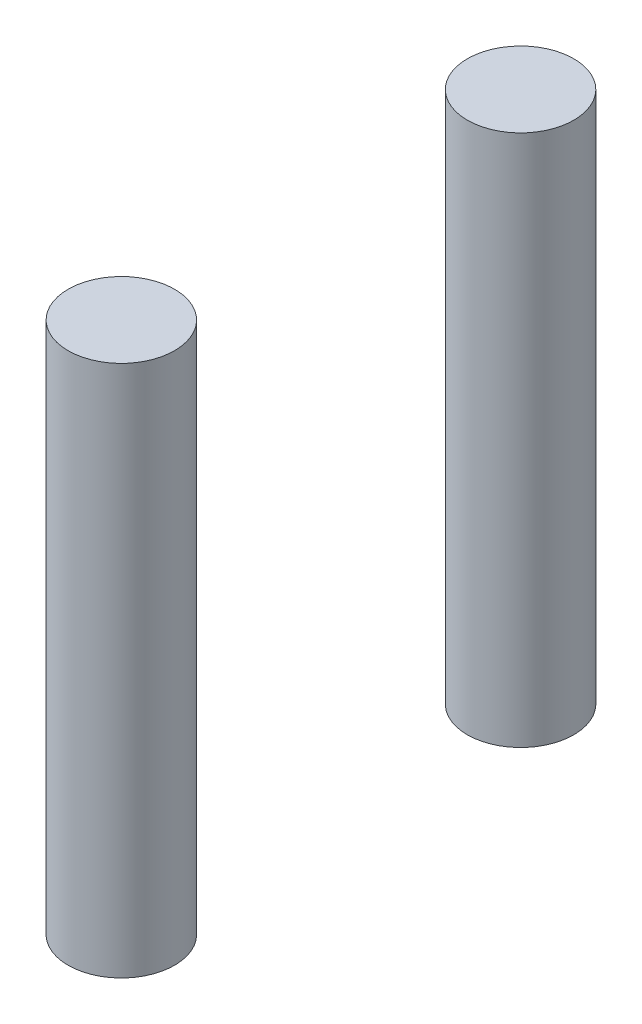
from build123d import *

# Parameters (mm, degrees)
EXTRUDE_START     = -3
SKETCH_1_R        = 1
EXTRUDE_3_DEPTH   = 10
EXTRUDE_3_2_DEPTH = 10


with BuildPart() as part:
    # Эскиз1 → Бобышка-Вытянуть3 (new body)
    with BuildSketch(Plane(origin=(0, 0, 0), x_dir=(1, 0, 0), z_dir=(0, 1, 0)).offset(EXTRUDE_START)):
        with Locations(Location((0, -3.75, 0), (0, 0, 270))):
            Circle(SKETCH_1_R)
    extrude(amount=-EXTRUDE_3_DEPTH)


with BuildPart() as body_2:
    # Эскиз1 → Extrude 3 2 (new body)
    with BuildSketch(Plane(origin=(0, 0, 0), x_dir=(1, 0, 0), z_dir=(0, 1, 0)).offset(EXTRUDE_START)):
        with Locations(Location((0, 3.75, 0), (0, 0, 270))):
            Circle(SKETCH_1_R)
    extrude(amount=-EXTRUDE_3_2_DEPTH)


solid = Compound([part.part, body_2.part])
